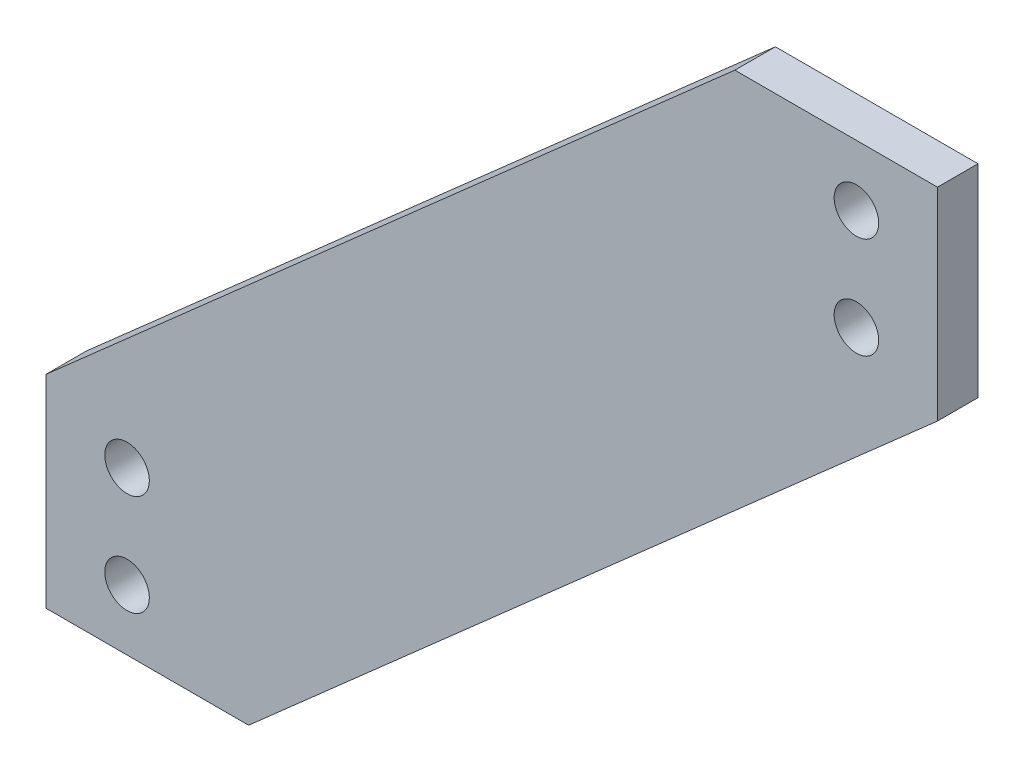
from build123d import *

# Parameters (mm, degrees)
BOSS_EXTRUDE1_DEPTH  = 5
BOSS_EXTRUDE2_DEPTH  = 5
M5_CLEARANCE_HOLE1_D = 5.5


with BuildPart() as part:
    # Sketch1 → Boss-Extrude1 (new body)
    with BuildSketch(Plane.XY):
        Polygon((0, 0), (20, 0), (110, 100), (90, 100), align=None)
    extrude(amount=BOSS_EXTRUDE1_DEPTH)

    # Sketch2 → Boss-Extrude2 (add)
    with BuildSketch(Plane.XY.offset(5)):
        Polygon((0, 0), (0, 25), (85, 100), (90, 100), (110, 100), (110, 75), (25, 0), align=None)
    extrude(amount=-BOSS_EXTRUDE2_DEPTH)

    # M5 Clearance Hole1 (through all)
    with Locations(Plane.XY.offset(5)):
        with Locations((100, 80), (10, 20), (10, 7.5), (100, 92.5)):
            Hole(M5_CLEARANCE_HOLE1_D / 2)


solid = part.part
